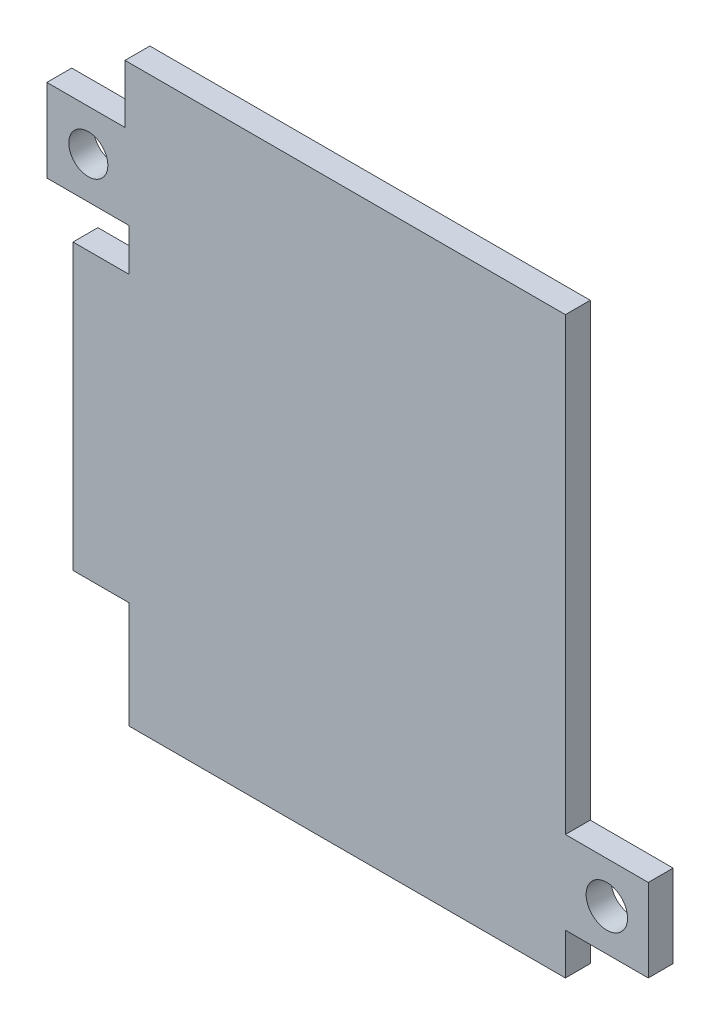
from build123d import *

# Parameters (mm, degrees)
SKETCH1_R           = 1.414036492
SKETCH1_R_2         = 1.5
BOSS_EXTRUDE1_DEPTH = 1.8


with BuildPart() as part:
    # Sketch1 → Boss-Extrude1 (new body)
    with BuildSketch(Plane.XY):
        Polygon((-14.604832392, 9.639595654), (-14.604832392, 6.577460034), (-18.658403667, 6.577460034), (-18.658403667, -14.020338192), (-14.604832392, -14.020338192), (-14.604832392, -21.750404346), (16.995167608, -21.750404346), (16.995167608, -18.750404346), (22.995167608, -18.750404346), (22.995167608, -12.757063543), (16.995167608, -12.750404346), (16.995167608, 19.849595654), (-14.894517711, 19.849595654), (-14.894517711, 15.639595654), (-20.550663677, 15.639595654), (-20.550663677, 9.639595654), align=None)
        with Locations((-17.550663677, 12.639595654)):
            Circle(SKETCH1_R, mode=Mode.SUBTRACT)
        with Locations((19.995167608, -15.753900813)):
            Circle(SKETCH1_R_2, mode=Mode.SUBTRACT)
    extrude(amount=BOSS_EXTRUDE1_DEPTH)


solid = part.part
